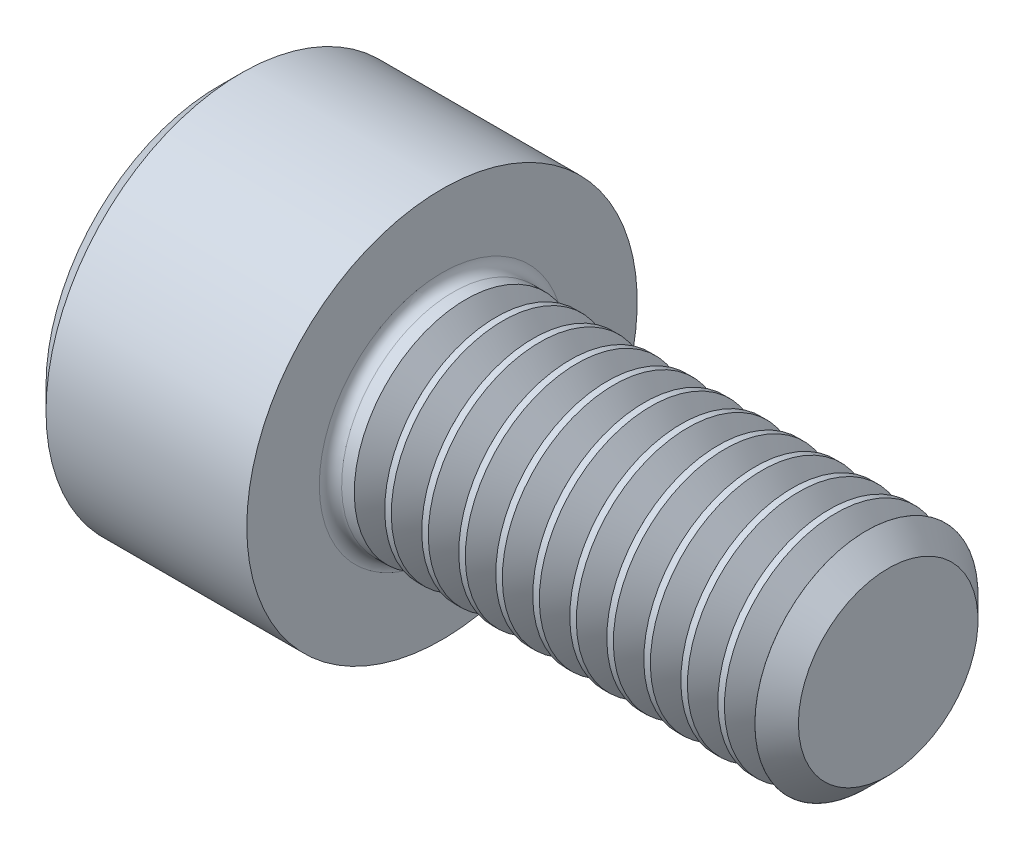
from build123d import *

# Parameters (mm, degrees)
FILLET1_R       = 0.2
HEX_2_DEPTH     = 2
THDSCHPAT_COUNT = 11
THDSCHPAT_PITCH = 0.663636364


with BuildPart() as part:
    # BodySke → Base-Revolve (revolve)
    with BuildSketch(Plane.XY, mode=Mode.PRIVATE) as base_revolve_sk:
        Polygon((0, 0), (0, 3.1), (0.4, 3.5), (4, 3.5), (4, 2), (11.61, 2), (12, 1.61), (12, 0), align=None)
    revolve(base_revolve_sk.sketch.rotate(Axis((-31.75, 0, 0), (1, 0, 0)), 90), axis=Axis((-31.75, 0, 0), (1, 0, 0)))

    # Fillet1
    fillet1_edges = [part.edges().sort_by_distance(p)[0] for p in [
        (4, 0, -2),
    ]]
    fillet(fillet1_edges, radius=FILLET1_R)

    # Sketch2 → Hex-PreBroach (revolve, cut)
    with BuildSketch(Plane.XY, mode=Mode.PRIVATE) as hex_prebroach_sk:
        Polygon((0, 1.5355), (2, 1.5355), (2.886521338, 0), (0, 0), align=None)
    revolve(hex_prebroach_sk.sketch.rotate(Axis((0, 0, 0), (1, 0, 0)), 90), axis=Axis((0, 0, 0), (1, 0, 0)), mode=Mode.SUBTRACT)

    # Sketch3 → Hex 2 (cut)
    with BuildSketch(Plane(origin=(0, 0, 0), x_dir=(0, 0.500000000000001, 0.866025403784438), z_dir=(-1, 0, 0))):
        Polygon((0.886521338, 1.5355), (-0.886521338, 1.5355), (-1.773042677, 0), (-0.886521338, -1.5355), (0.886521338, -1.5355), (1.773042677, 0), align=None)
    extrude(amount=-HEX_2_DEPTH, mode=Mode.SUBTRACT)

    # ThdSchSke → ThreadSchematic (revolve, cut)
    with BuildSketch(Plane.XY):
        Polygon((4.7, -1.61), (4.42691906, -2), (4.42691906, -2.5), (4.97308094, -2.5), (4.97308094, -2), align=None)
    threadschematic = revolve(axis=Axis((-3.175, 0, 0), (1, 0, 0)), mode=Mode.SUBTRACT)

    # ThdSchPat: ThreadSchematic ×11
    with Locations(*[(i * THDSCHPAT_PITCH, 0, 0) for i in range(1, THDSCHPAT_COUNT)]):
        add(threadschematic, mode=Mode.SUBTRACT)


solid = part.part
